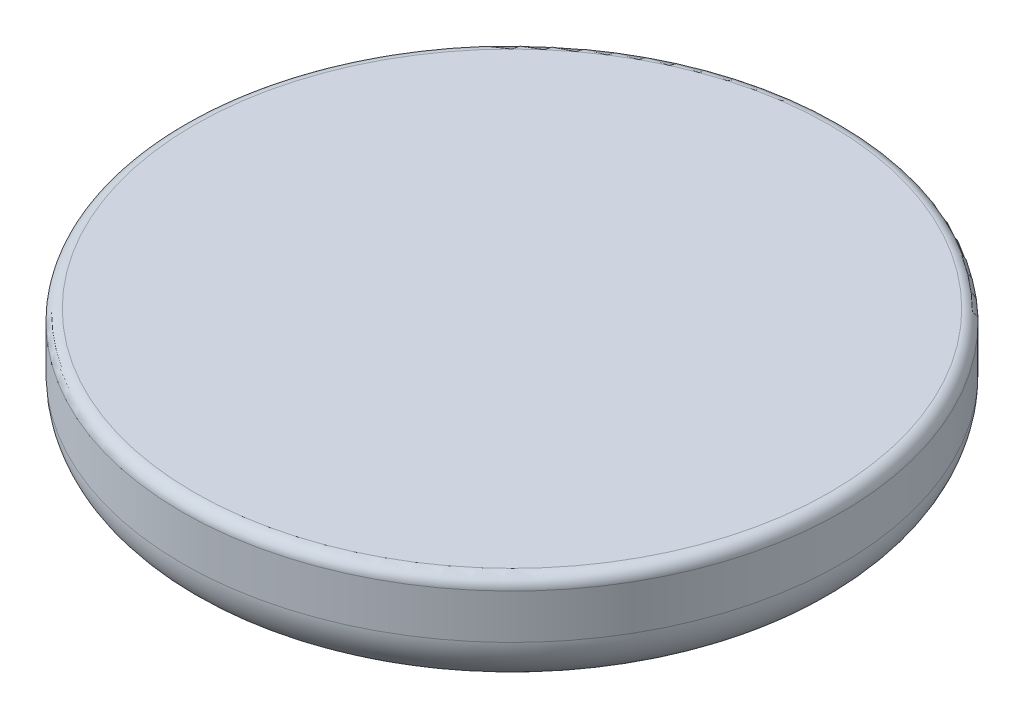
from build123d import *

# Parameters (mm, degrees)
SKETCH1_R           = 10
BOSS_EXTRUDE1_DEPTH = 3.2
FILLET1_R           = 0.35
FILLET2_R           = 1.5


with BuildPart() as part:
    # Sketch1 → Boss-Extrude1 (new body)
    with BuildSketch(Plane(origin=(0, 0, 0), x_dir=(1, 0, 0), z_dir=(0, 1, 0))):
        with Locations(Location((0, 0, 0), (0, 0, 270))):
            Circle(SKETCH1_R)
    extrude(amount=BOSS_EXTRUDE1_DEPTH)

    # Fillet1
    fillet1_edges = [part.edges().sort_by_distance(p)[0] for p in [
        (0, 3.2, -10),
    ]]
    fillet(fillet1_edges, radius=FILLET1_R)

    # Fillet2
    fillet2_edges = [part.edges().sort_by_distance(p)[0] for p in [
        (0, 0, -10),
    ]]
    fillet(fillet2_edges, radius=FILLET2_R)


solid = part.part
